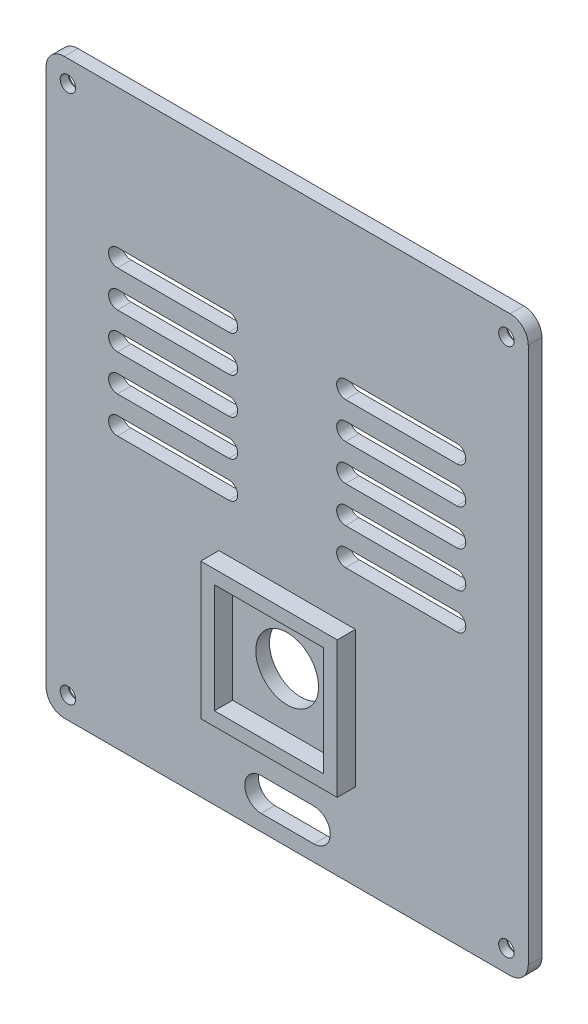
from build123d import *

# Parameters (mm, degrees)
SKETCH_1_W          = 53
SKETCH_1_H          = 63
EXTRUDE_1_DEPTH     = 1.5
FILLET_1_R          = 2
CUT_EXTRUDE_2_DEPTH = 83.342273469
CUT_EXTRUDE_3_DEPTH = 83.342273469
SKETCH_5_R          = 3.45
CUT_EXTRUDE_4_DEPTH = 83.342273469
SKETCH_6_W          = 15
SKETCH_6_H          = 15
SKETCH_6_W_2        = 12
SKETCH_6_H_2        = 12
EXTRUDE_1_2_DEPTH   = 2
SKETCH_9_R          = 0.85
CUT_EXTRUDE_5_DEPTH = 83.402973247
SKETCH_10_R         = 1.55
CUT_EXTRUDE_6_DEPTH = 0.6


with BuildPart() as part:
    # 草图1 → Extrude 1 (new body)
    with BuildSketch(Plane.XY):
        with Locations((26.5, 31.5)):
            Rectangle(SKETCH_1_W, SKETCH_1_H)
    extrude(amount=EXTRUDE_1_DEPTH)

    # 圆角1
    fillet_1_edges = [part.edges().sort_by_distance(p)[0] for p in [
        (0, 63, 0.75),
        (53, 63, 0.75),
        (53, 0, 0.75),
        (0, 0, 0.75),
    ]]
    fillet(fillet_1_edges, radius=FILLET_1_R)

    # 草图3 → 切除-拉伸2 (cut, through all)
    with BuildSketch(Plane(origin=(0, 0, 0), x_dir=(-1, 0, 0), z_dir=(0, 0, -1))):
        with BuildLine():
            Line((-23.635661643, 5.35), (-29.435661643, 5.35))
            ThreePointArc((-29.435661643, 5.35), (-31.235661643, 3.55), (-29.435661643, 1.75))
            Line((-29.435661643, 1.75), (-23.635661643, 1.75))
            ThreePointArc((-23.635661643, 1.75), (-21.835661643, 3.55), (-23.635661643, 5.35))
        make_face()
    extrude(amount=-CUT_EXTRUDE_2_DEPTH, mode=Mode.SUBTRACT)

    # 草图4 → 切除-拉伸3 (cut, through all)
    with BuildSketch(Plane.XY.offset(1.5)):
        with BuildLine():
            Line((7.840284333, 47.730065189), (20.08572274, 47.730065189))
            ThreePointArc((20.08572274, 47.730065189), (21.057582931, 46.758204998), (20.08572274, 45.786344807))
            Line((20.08572274, 45.786344807), (7.840284333, 45.786344807))
            ThreePointArc((7.840284333, 45.786344807), (6.868424142, 46.758204998), (7.840284333, 47.730065189))
        make_face()
        with BuildLine():
            Line((7.840284333, 43.730065189), (20.08572274, 43.730065189))
            ThreePointArc((20.08572274, 43.730065189), (21.057582931, 42.758204998), (20.08572274, 41.786344807))
            Line((20.08572274, 41.786344807), (7.840284333, 41.786344807))
            ThreePointArc((7.840284333, 41.786344807), (6.868424142, 42.758204998), (7.840284333, 43.730065189))
        make_face()
        with BuildLine():
            Line((7.840284333, 39.730065189), (20.08572274, 39.730065189))
            ThreePointArc((20.08572274, 39.730065189), (21.057582931, 38.758204998), (20.08572274, 37.786344807))
            Line((20.08572274, 37.786344807), (7.840284333, 37.786344807))
            ThreePointArc((7.840284333, 37.786344807), (6.868424142, 38.758204998), (7.840284333, 39.730065189))
        make_face()
        with BuildLine():
            Line((7.840284333, 35.730065189), (20.08572274, 35.730065189))
            ThreePointArc((20.08572274, 35.730065189), (21.057582931, 34.758204998), (20.08572274, 33.786344807))
            Line((20.08572274, 33.786344807), (7.840284333, 33.786344807))
            ThreePointArc((7.840284333, 33.786344807), (6.868424142, 34.758204998), (7.840284333, 35.730065189))
        make_face()
        with BuildLine():
            Line((7.840284333, 31.730065189), (20.08572274, 31.730065189))
            ThreePointArc((20.08572274, 31.730065189), (21.057582931, 30.758204998), (20.08572274, 29.786344807))
            Line((20.08572274, 29.786344807), (7.840284333, 29.786344807))
            ThreePointArc((7.840284333, 29.786344807), (6.868424142, 30.758204998), (7.840284333, 31.730065189))
        make_face()
        with BuildLine():
            Line((45.159715667, 31.730065189), (32.91427726, 31.730065189))
            ThreePointArc((32.91427726, 31.730065189), (31.942417069, 30.758204998), (32.91427726, 29.786344807))
            Line((32.91427726, 29.786344807), (45.159715667, 29.786344807))
            ThreePointArc((45.159715667, 29.786344807), (46.131575858, 30.758204998), (45.159715667, 31.730065189))
        make_face()
        with BuildLine():
            Line((45.159715667, 35.730065189), (32.91427726, 35.730065189))
            ThreePointArc((32.91427726, 35.730065189), (31.942417069, 34.758204998), (32.91427726, 33.786344807))
            Line((32.91427726, 33.786344807), (45.159715667, 33.786344807))
            ThreePointArc((45.159715667, 33.786344807), (46.131575858, 34.758204998), (45.159715667, 35.730065189))
        make_face()
        with BuildLine():
            Line((45.159715667, 39.730065189), (32.91427726, 39.730065189))
            ThreePointArc((32.91427726, 39.730065189), (31.942417069, 38.758204998), (32.91427726, 37.786344807))
            Line((32.91427726, 37.786344807), (45.159715667, 37.786344807))
            ThreePointArc((45.159715667, 37.786344807), (46.131575858, 38.758204998), (45.159715667, 39.730065189))
        make_face()
        with BuildLine():
            Line((45.159715667, 43.730065189), (32.91427726, 43.730065189))
            ThreePointArc((32.91427726, 43.730065189), (31.942417069, 42.758204998), (32.91427726, 41.786344807))
            Line((32.91427726, 41.786344807), (45.159715667, 41.786344807))
            ThreePointArc((45.159715667, 41.786344807), (46.131575858, 42.758204998), (45.159715667, 43.730065189))
        make_face()
        with BuildLine():
            Line((45.159715667, 47.730065189), (32.91427726, 47.730065189))
            ThreePointArc((32.91427726, 47.730065189), (31.942417069, 46.758204998), (32.91427726, 45.786344807))
            Line((32.91427726, 45.786344807), (45.159715667, 45.786344807))
            ThreePointArc((45.159715667, 45.786344807), (46.131575858, 46.758204998), (45.159715667, 47.730065189))
        make_face()
    extrude(amount=-CUT_EXTRUDE_3_DEPTH, mode=Mode.SUBTRACT)

    # 草图5 → 切除-拉伸4 (cut, through all)
    with BuildSketch(Plane.XY.offset(1.5)):
        with Locations((26.5, 16.954492475)):
            Circle(SKETCH_5_R)
    extrude(amount=-CUT_EXTRUDE_4_DEPTH, mode=Mode.SUBTRACT)

    # 草图6 → Extrude 1 2 (add)
    with BuildSketch(Plane.XY.offset(1.5)):
        with Locations((26.5, 16.954492475)):
            Rectangle(SKETCH_6_W, SKETCH_6_H)
        with Locations((26.5, 16.954492475)):
            Rectangle(SKETCH_6_W_2, SKETCH_6_H_2, mode=Mode.SUBTRACT)
    extrude(amount=EXTRUDE_1_2_DEPTH)

    # 草图9 → 切除-拉伸5 (cut, through all)
    with BuildSketch(Plane(origin=(0, 0, 0), x_dir=(-1, 0, 0), z_dir=(0, 0, -1))):
        with Locations((-2.4, 2.4)):
            Circle(SKETCH_9_R)
        with Locations((-50.6, 60.6)):
            Circle(SKETCH_9_R)
        with Locations((-2.4, 60.6)):
            Circle(SKETCH_9_R)
        with Locations((-50.6, 2.4)):
            Circle(SKETCH_9_R)
    extrude(amount=-CUT_EXTRUDE_5_DEPTH, mode=Mode.SUBTRACT)

    # 草图10 → 切除-拉伸6 (cut)
    with BuildSketch(Plane(origin=(0, 0, 0), x_dir=(-1, 0, 0), z_dir=(0, 0, -1))):
        with Locations((-50.6, 60.6)):
            Circle(SKETCH_10_R)
        with Locations(Location((-2.4, 60.6, 0), (0, 0, 180))):
            Circle(SKETCH_10_R)
        with Locations((-2.4, 2.4)):
            Circle(SKETCH_10_R)
        with Locations(Location((-50.6, 2.4, 0), (0, 0, 180))):
            Circle(SKETCH_10_R)
    extrude(amount=-CUT_EXTRUDE_6_DEPTH, mode=Mode.SUBTRACT)


solid = part.part
